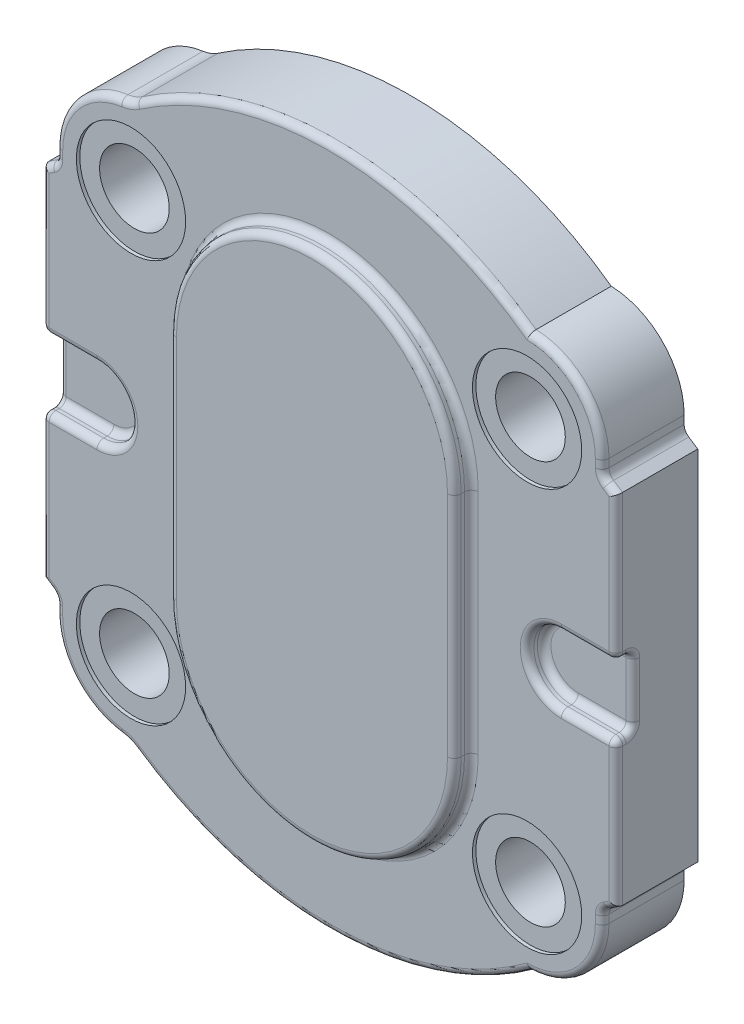
from build123d import *

# Parameters (mm, degrees)
IZIM1_R                     = 5.1
Y_KSEKLIK_EKSTR_ZYON1_DEPTH = 12
Y_KSEKLIK_EKSTR_ZYON3_DEPTH = 2.5
KES_EKSTR_ZYON3_DEPTH       = 2.5
IZIM6_R                     = 8
KES_EKSTR_ZYON4_DEPTH       = 0.5
RADYUS1_R                   = 1


with BuildPart() as part:
    # Çizim1 → Yükseklik-Ekstrüzyon1 (new body)
    with BuildSketch(Plane.XY):
        with BuildLine():
            ThreePointArc((-30.445342697, 40.404631332), (-37.273414339, 36.74918031), (-40, 29.5))
            Line((-40, 29.5), (-40, 28.305972781))
            ThreePointArc((-40, 28.305972781), (-40.180221035, 27.593102888), (-40.677577979, 27.051531862))
            Line((-40.677577979, 27.051531862), (-42, 26.184540858))
            Line((-42, 26.184540858), (-42, -26.184540858))
            Line((-42, -26.184540858), (-40.677577979, -27.051531862))
            ThreePointArc((-40.677577979, -27.051531862), (-40.180221035, -27.593102888), (-40, -28.305972781))
            Line((-40, -28.305972781), (-40, -29.5))
            ThreePointArc((-40, -29.5), (-37.273414339, -36.74918031), (-30.445342697, -40.404631332))
            ThreePointArc((-30.445342697, -40.404631332), (-29.311006992, -40.693176357), (-28.274833318, -41.237529034))
            ThreePointArc((-28.274833318, -41.237529034), (0, -50), (28.274833318, -41.237529034))
            ThreePointArc((28.274833318, -41.237529034), (28.803938458, -40.86970919), (29.328259336, -40.495100991))
            ThreePointArc((29.328259336, -40.495100991), (29.887953959, -40.464102233), (30.445342697, -40.404631332))
            ThreePointArc((30.445342697, -40.404631332), (37.273414339, -36.74918031), (40, -29.5))
            Line((40, -29.5), (40, -28.305972781))
            ThreePointArc((40, -28.305972781), (40.180221035, -27.593102888), (40.677577979, -27.051531862))
            Line((40.677577979, -27.051531862), (42, -26.184540858))
            Line((42, -26.184540858), (42, 26.184540858))
            Line((42, 26.184540858), (40.677577979, 27.051531862))
            ThreePointArc((40.677577979, 27.051531862), (40.180221035, 27.593102888), (40, 28.305972781))
            Line((40, 28.305972781), (40, 29.5))
            ThreePointArc((40, 29.5), (37.273414339, 36.74918031), (30.445342697, 40.404631332))
            ThreePointArc((30.445342697, 40.404631332), (29.887953959, 40.464102233), (29.328259336, 40.495100991))
            ThreePointArc((29.328259336, 40.495100991), (28.803938458, 40.86970919), (28.274833318, 41.237529034))
            ThreePointArc((28.274833318, 41.237529034), (0, 50), (-28.274833318, 41.237529034))
            ThreePointArc((-28.274833318, 41.237529034), (-29.311006992, 40.693176357), (-30.445342697, 40.404631332))
        make_face()
        with Locations((-29, -29.5)):
            Circle(IZIM1_R, mode=Mode.SUBTRACT)
        with Locations((29, -29.5)):
            Circle(IZIM1_R, mode=Mode.SUBTRACT)
        with Locations((-29, 29.5)):
            Circle(IZIM1_R, mode=Mode.SUBTRACT)
        with Locations((29, 29.5)):
            Circle(IZIM1_R, mode=Mode.SUBTRACT)
    extrude(amount=Y_KSEKLIK_EKSTR_ZYON1_DEPTH)

    # Çizim2 → Yükseklik-Ekstrüzyon3 (add)
    with BuildSketch(Plane.XY.offset(12)):
        with BuildLine():
            Line((20.85, -16.68), (20.85, 16.68))
            ThreePointArc((20.85, 16.68), (0, 37.53), (-20.85, 16.68))
            Line((-20.85, 16.68), (-20.85, -16.68))
            ThreePointArc((-20.85, -16.68), (0, -37.53), (20.85, -16.68))
        make_face()
    extrude(amount=Y_KSEKLIK_EKSTR_ZYON3_DEPTH)

    # Çizim5 → Kes-Ekstrüzyon3 (cut)
    with BuildSketch(Plane.XY.offset(12)):
        with BuildLine():
            Line((-34, 5.072923691), (-45.431287404, 5.072923691))
            Line((-45.431287404, 5.072923691), (-45.431287404, -4.927076309))
            Line((-45.431287404, -4.927076309), (-34, -4.927076309))
            ThreePointArc((-34, -4.927076309), (-29, 0.072923691), (-34, 5.072923691))
        make_face()
        with BuildLine():
            Line((34, 5), (44.190816649, 5))
            Line((44.190816649, 5), (44.190816649, -5))
            Line((44.190816649, -5), (34, -5))
            ThreePointArc((34, -5), (29, 0), (34, 5))
        make_face()
    extrude(amount=-KES_EKSTR_ZYON3_DEPTH, mode=Mode.SUBTRACT)

    # Çizim6 → Kes-Ekstrüzyon4 (cut)
    with BuildSketch(Plane.XY.offset(12)):
        with Locations((-29, 29.5)):
            Circle(IZIM6_R)
        with Locations((-29, -29.5)):
            Circle(IZIM6_R)
        with Locations((29, 29.5)):
            Circle(IZIM6_R)
        with Locations((29, -29.5)):
            Circle(IZIM6_R)
    extrude(amount=-KES_EKSTR_ZYON4_DEPTH, mode=Mode.SUBTRACT)

    # Radyus1
    radyus1_edges = [part.edges().sort_by_distance(p)[0] for p in [
        (0.644380667, -49.995847563, 12),
        (-42, 0.072923691, 9.5),
        (42, 0, 9.5),
        (-40.180221035, -27.593102888, 12),
        (42, 5, 10.75),
        (42, -5, 10.75),
        (29, 0, 9.5),
        (38, 5, 9.5),
        (38, -5, 9.5),
        (38, -5, 12),
        (29, 0, 12),
        (-40, -28.902986391, 12),
        (-37.273414339, -36.74918031, 12),
        (-38, 5.072923691, 12),
        (-29, 0.072923691, 12),
        (-38, 5.072923691, 9.5),
        (-42, 5.072923691, 10.75),
        (-42, -4.927076309, 10.75),
        (-38, -4.927076309, 9.5),
        (-29, 0.072923691, 9.5),
        (-29.311006992, -40.693176357, 12),
        (36.89337864, -37.161238389, 12),
        (40, -28.902986391, 12),
        (40.180221035, -27.593102888, 12),
        (41.338788989, -26.61803636, 12),
        (42, 15.592270429, 12),
        (41.338788989, 26.61803636, 12),
        (40.180221035, 27.593102888, 12),
        (40, 28.902986391, 12),
        (36.89337864, 37.161238389, 12),
        (0.644380667, 49.995847563, 12),
        (-29.311006992, 40.693176357, 12),
        (-37.273414339, 36.74918031, 12),
        (-40, 28.902986391, 12),
        (-40.180221035, 27.593102888, 12),
        (0, -37.53, 12),
        (20.85, 0, 12),
        (0, 37.53, 12),
        (-20.85, 0, 12),
        (0, -37.53, 14.5),
        (20.85, 0, 14.5),
        (0, 37.53, 14.5),
        (-20.85, 0, 14.5),
        (-41.338788989, 26.61803636, 12),
        (-42, 15.628732275, 12),
        (42, -15.592270429, 12),
        (-41.338788989, -26.61803636, 12),
        (-42, -15.555808584, 12),
        (-38, -4.927076309, 12),
        (38, 5, 12),
    ]]
    fillet(radyus1_edges, radius=RADYUS1_R)


solid = part.part
